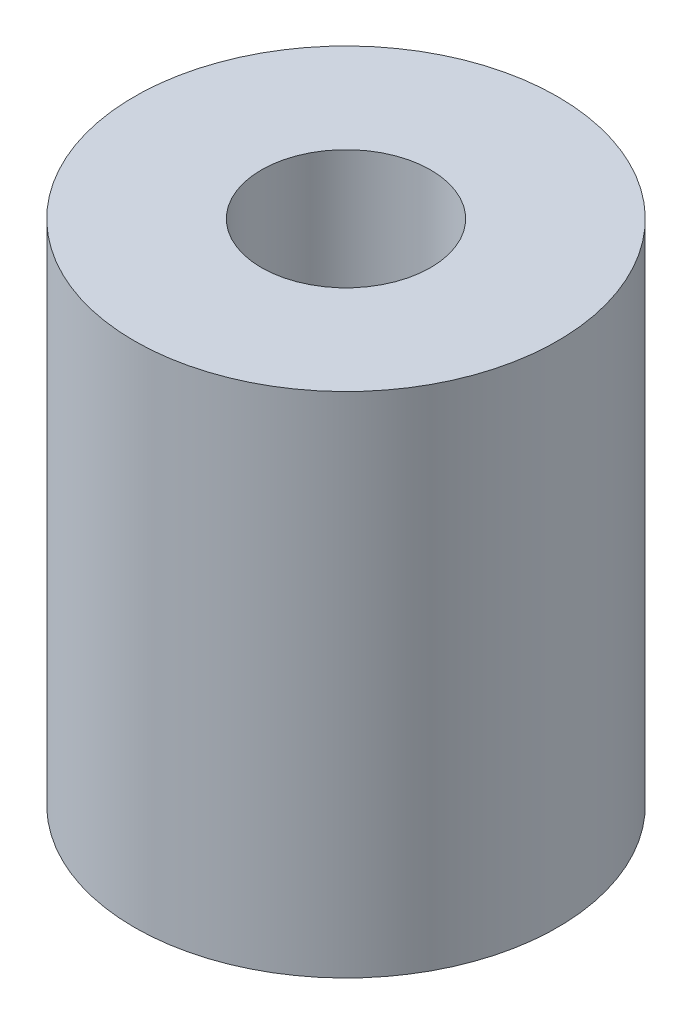
from build123d import *

# Parameters (mm, degrees)
SKETCH1_R           = 5
BOSS_EXTRUDE1_DEPTH = 12
CUT_EXTRUDE1_REACH  = 15.928
SKETCH2_R           = 2


with BuildPart() as part:
    # Sketch1 → Boss-Extrude1 (new body)
    with BuildSketch(Plane(origin=(0, 0, 0), x_dir=(1, 0, 0), z_dir=(0, 1, 0))):
        with Locations(Location((0, 0, 0), (0, 0, 270))):
            Circle(SKETCH1_R)
    extrude(amount=BOSS_EXTRUDE1_DEPTH)

    # Sketch2 → Cut-Extrude1 (cut, up to next)
    with BuildSketch(Plane(origin=(0, 12, 0), x_dir=(1, 0, 0), z_dir=(0, 1, 0)), mode=Mode.PRIVATE) as cut_extrude1_sk1:
        with Locations(Location((0, 0, 0), (0, 0, 270))):
            Circle(SKETCH2_R)
    cut_extrude1_tool1 = extrude(cut_extrude1_sk1.sketch, amount=-CUT_EXTRUDE1_REACH, mode=Mode.PRIVATE) & part.part
    add(cut_extrude1_tool1.solids().sort_by_distance((0, 12, 0))[0], mode=Mode.SUBTRACT)


solid = part.part
